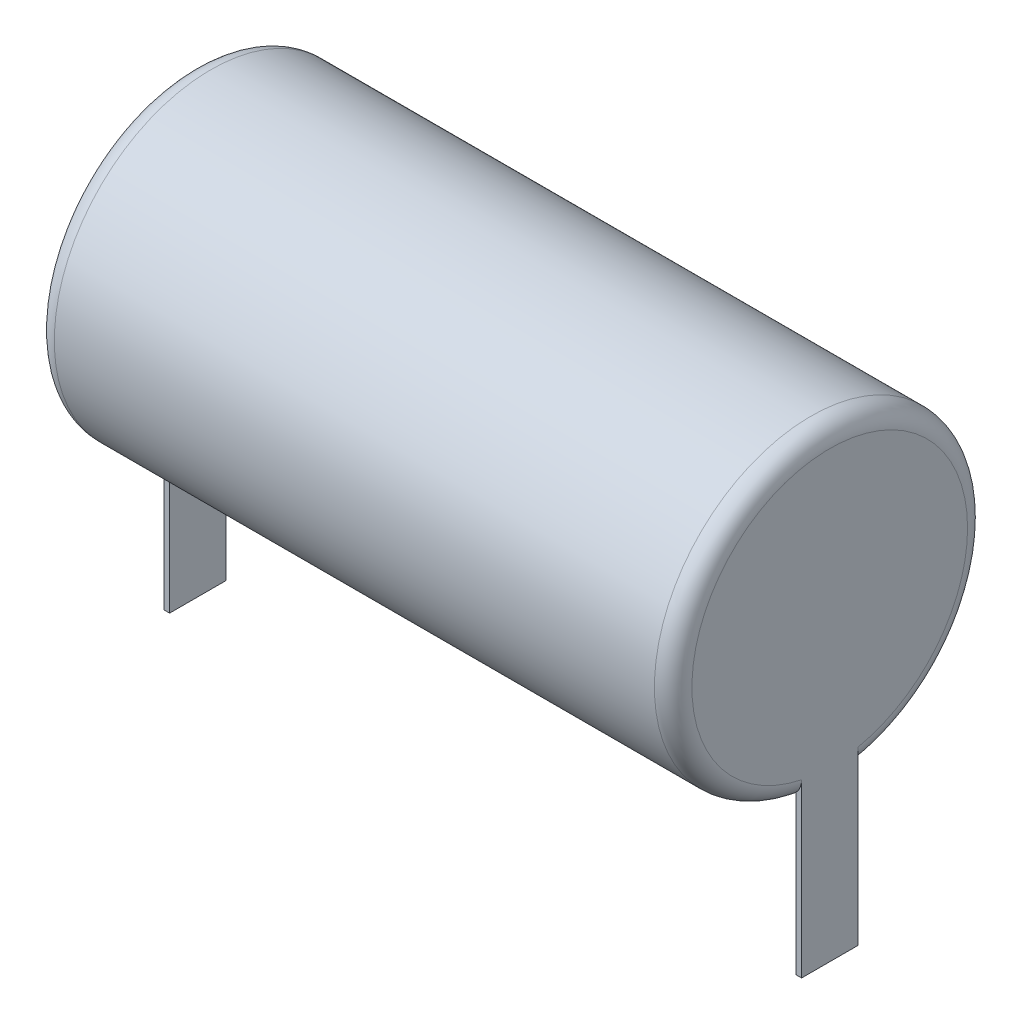
from build123d import *

# Parameters (mm, degrees)
SKETCH_1_R      = 8.35
EXTRUDE_1_DEPTH = 17
FILLET_1_R      = 1
SKETCH_2_W      = 3
SKETCH_2_H      = 16.35
EXTRUDE_2_DEPTH = 0.3


with BuildPart() as part:
    # Эскиз1 → Бобышка-Вытянуть1 (new, symmetric)
    with BuildSketch(Plane(origin=(0, 0, 0), x_dir=(0, 0, -1), z_dir=(1, 0, 0))):
        Circle(SKETCH_1_R)
    extrude(amount=EXTRUDE_1_DEPTH, both=True)

    # Скругление1
    fillet_1_edges = [part.edges().sort_by_distance(p)[0] for p in [
        (-17, 0, 8.35),
        (17, 0, 8.35),
    ]]
    fillet(fillet_1_edges, radius=FILLET_1_R)

    # Эскиз2 → Бобышка-Вытянуть2 (add)
    with BuildSketch(Plane(origin=(17, 0, 0), x_dir=(0, 0, -1), z_dir=(1, 0, 0))):
        with Locations((0, -8.175)):
            Rectangle(SKETCH_2_W, SKETCH_2_H)
    extrude_2 = extrude(amount=-EXTRUDE_2_DEPTH)

    # Зеркальное отражение1: Бобышка-Вытянуть2 across plane
    add(extrude_2.mirror(Plane(origin=(0, 0, 0), x_dir=(0, 0, 1), z_dir=(1, 0, 0))))


solid = part.part
